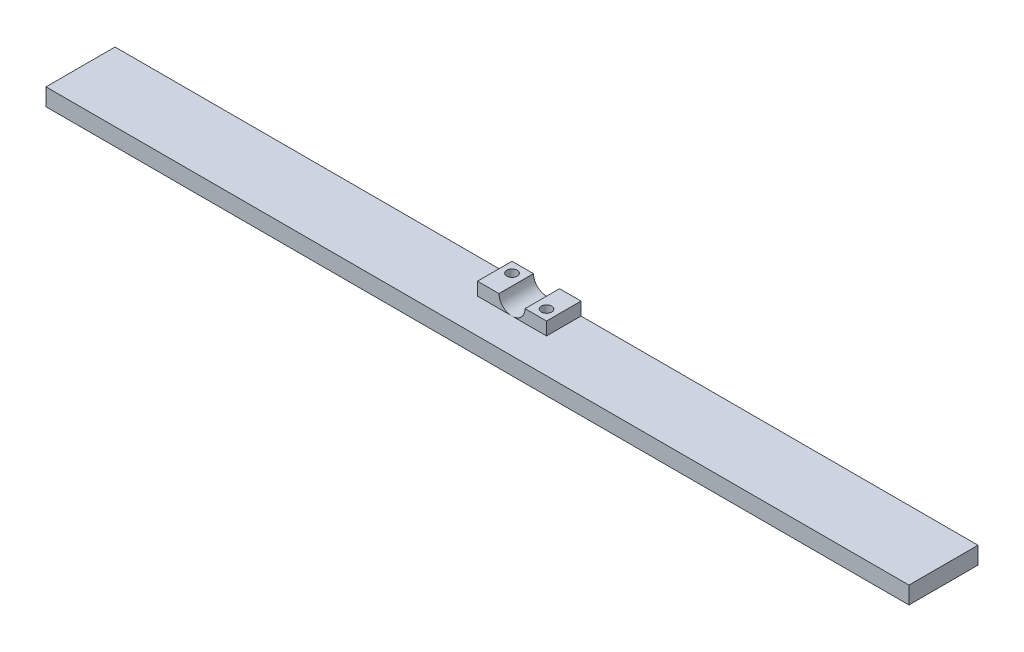
from build123d import *

# Parameters (mm, degrees)
SKETCH1_W           = 250
SKETCH1_H           = 20
BOSS_EXTRUDE1_DEPTH = 5
SKETCH2_W           = 20
SKETCH2_H           = 10
BOSS_EXTRUDE2_DEPTH = 3.75
SKETCH3_R           = 3.775
CUT_EXTRUDE1_DEPTH  = 10
SKETCH4_R           = 1.5
CUT_EXTRUDE2_DEPTH  = 4


with BuildPart() as part:
    # Sketch1 → Boss-Extrude1 (new body)
    with BuildSketch(Plane(origin=(0, 0, 0), x_dir=(1, 0, 0), z_dir=(0, 1, 0))):
        with Locations((82.077816098, -3.273623345)):
            Rectangle(SKETCH1_W, SKETCH1_H)
    extrude(amount=BOSS_EXTRUDE1_DEPTH)

    # Sketch2 → Boss-Extrude2 (add)
    with BuildSketch(Plane(origin=(0, 5, 0), x_dir=(1, 0, 0), z_dir=(0, 1, 0))):
        with Locations((82.077816098, 1.726376655)):
            Rectangle(SKETCH2_W, SKETCH2_H)
    extrude(amount=BOSS_EXTRUDE2_DEPTH)

    # Sketch3 → Cut-Extrude1 (cut)
    with BuildSketch(Plane.XY.offset(3.273623345)):
        with Locations((82.077816098, 8.75)):
            Circle(SKETCH3_R)
    extrude(amount=-CUT_EXTRUDE1_DEPTH, mode=Mode.SUBTRACT)

    # Sketch4 → Cut-Extrude2 (cut)
    with BuildSketch(Plane(origin=(0, 8.75, 0), x_dir=(1, 0, 0), z_dir=(0, 1, 0))):
        with Locations(Location((89.077816098, -0.273623345, 0), (0, 0, 270))):
            Circle(SKETCH4_R)
        with Locations(Location((75.077816098, 3.726376655, 0), (0, 0, 270))):
            Circle(SKETCH4_R)
    extrude(amount=-CUT_EXTRUDE2_DEPTH, mode=Mode.SUBTRACT)


solid = part.part
